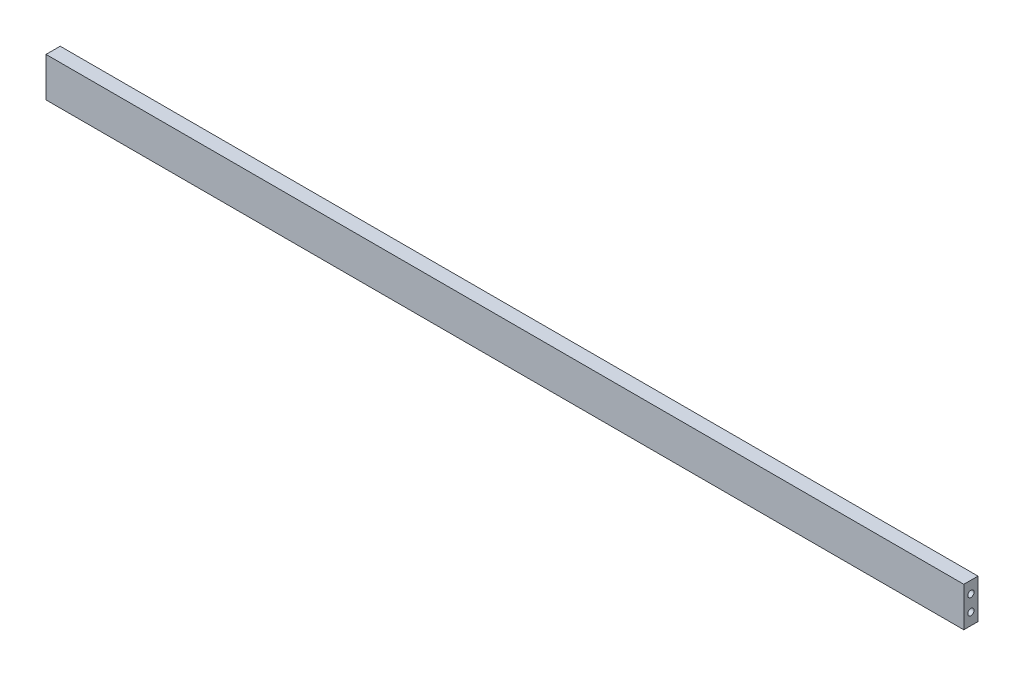
from build123d import *

# Parameters (mm, degrees)
SKETCH1_W      = 1164
SKETCH1_H      = 18
PLINTH_DEPTH   = 50
SKETCH2_R      = 4
EXTRUDE1_DEPTH = 10
EXTRUDE2_START = 10
SKETCH3_R      = 4
EXTRUDE2_DEPTH = 10


with BuildPart() as part:
    # Sketch1 → Plinth (new body)
    with BuildSketch(Plane(origin=(0, -50, 0), x_dir=(-1, 0, 0), z_dir=(0, 1, 0))):
        with Locations((582, -9)):
            Rectangle(SKETCH1_W, SKETCH1_H)
    extrude(amount=PLINTH_DEPTH)

    # Sketch2 → Extrude1 (cut)
    with BuildSketch(Plane(origin=(0, 0, 0), x_dir=(0, 0, -1), z_dir=(1, 0, 0))):
        with Locations((9, -15)):
            Circle(SKETCH2_R)
        with Locations((9, -35)):
            Circle(SKETCH2_R)
    extrude(amount=-EXTRUDE1_DEPTH, mode=Mode.SUBTRACT)

    # Sketch3 → Extrude2 (cut)
    with BuildSketch(Plane(origin=(-1164, 0, 0), x_dir=(0, 0, -1), z_dir=(1, 0, 0)).offset(EXTRUDE2_START)):
        with Locations((9, -35)):
            Circle(SKETCH3_R)
        with Locations((9, -15)):
            Circle(SKETCH3_R)
    extrude(amount=-EXTRUDE2_DEPTH, mode=Mode.SUBTRACT)


solid = part.part
